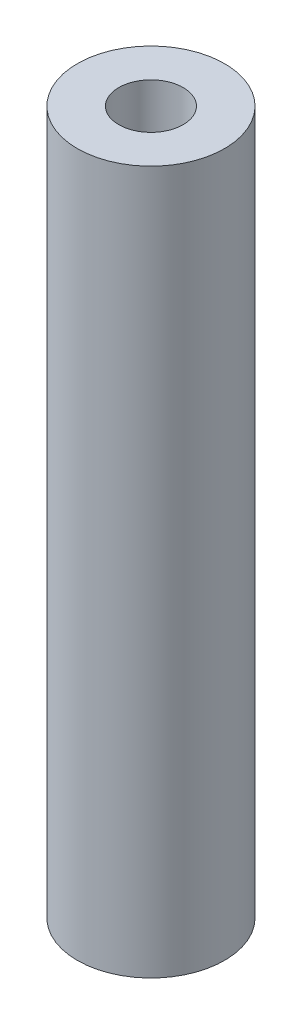
from build123d import *

# Parameters (mm, degrees)
SKETCH_1_R      = 4
SKETCH_1_R_2    = 1.75
EXTRUDE_1_DEPTH = 38.2


with BuildPart() as part:
    # 草图1 → 凸台-拉伸1 (new body)
    with BuildSketch(Plane(origin=(0, 0, 0), x_dir=(1, 0, 0), z_dir=(0, 1, 0))):
        with Locations(Location((0, 0, 0), (0, 0, 270))):
            Circle(SKETCH_1_R)
        with Locations(Location((0, 0, 0), (0, 0, 270))):
            Circle(SKETCH_1_R_2, mode=Mode.SUBTRACT)
    extrude(amount=EXTRUDE_1_DEPTH)


solid = part.part
